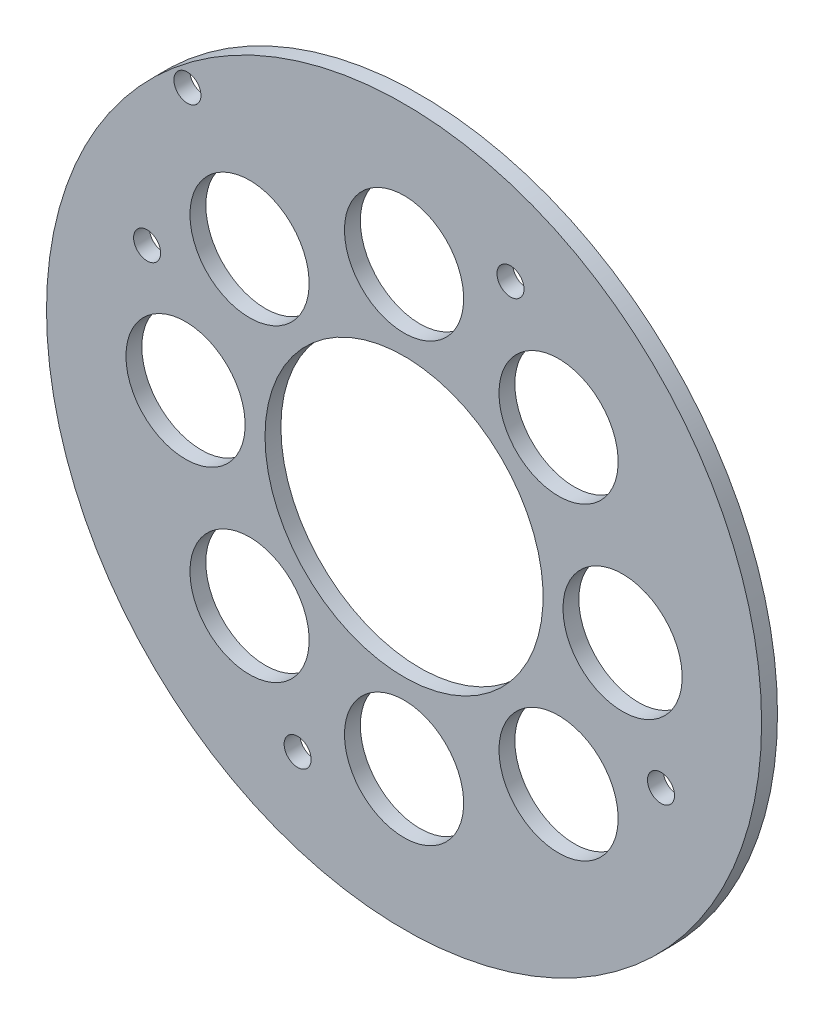
from build123d import *

# Parameters (mm, degrees)
SKETCH_1_R          = 40
EXTRUDE_1_DEPTH     = 12
SKETCH_8_R          = 45
EXTRUDE_3_DEPTH     = 2
SKETCH_2_R          = 7.5
CUT_EXTRUDE_1_DEPTH = 66.161338231
HOLE_WIZARD_M31_D   = 3.4
HOLE_WIZARD_M32_D   = 3.4
SKETCH_10_R         = 7.5
CUT_EXTRUDE_2_DEPTH = 66.161338231
HOLE_WIZARD_M33_D   = 3.4
SKETCH_17_R         = 17
CUT_EXTRUDE_3_DEPTH = 1.5
SKETCH_18_R         = 44.163841719
CUT_EXTRUDE_4_DEPTH = 12
SKETCH_19_R         = 17.5
CUT_EXTRUDE_5_DEPTH = 64.671029519


with BuildPart() as part:
    # Эскиз1 → Бобышка-Вытянуть1 (new body)
    with BuildSketch(Plane.XY):
        Circle(SKETCH_1_R)
    extrude(amount=EXTRUDE_1_DEPTH)

    # Эскиз8 → Бобышка-Вытянуть3 (add)
    with BuildSketch(Plane.XY.offset(12)):
        Circle(SKETCH_8_R)
    extrude(amount=EXTRUDE_3_DEPTH)

    # Эскиз2 → Вырез-Вытянуть1 (cut, through all)
    with BuildSketch(Plane(origin=(0, 0, 14), x_dir=(-1, 0, 0), z_dir=(0, 0, -1))):
        Circle(SKETCH_2_R)
    extrude(amount=CUT_EXTRUDE_1_DEPTH, mode=Mode.SUBTRACT)

    # Отверстие с зазором M31 (through all)
    with Locations(Plane(origin=(-6.663493146, -3.889871465, 14), x_dir=(-1, 0, 0), z_dir=(0, 0, 1))):
        with Locations((20.599623529, -37.010635762)):
            Hole(HOLE_WIZARD_M31_D / 2)

    # Отверстие с зазором M32 (through all)
    with Locations(Plane.XY.offset(14)):
        with Locations((0, 12.5), (-12.5, 0), (0, -12.5), (12.5, 0)):
            Hole(HOLE_WIZARD_M32_D / 2)

    # Эскиз10 → Вырез-Вытянуть2 (cut, through all)
    with BuildSketch(Plane(origin=(0, 0, 0), x_dir=(-1, 0, 0), z_dir=(0, 0, -1))):
        with Locations((0, 27.5)):
            Circle(SKETCH_10_R)
        with Locations((19.445436483, 19.445436483)):
            Circle(SKETCH_10_R)
        with Locations((27.5, 0)):
            Circle(SKETCH_10_R)
        with Locations((19.445436483, -19.445436483)):
            Circle(SKETCH_10_R)
        with Locations((0, -27.5)):
            Circle(SKETCH_10_R)
        with Locations((-19.445436483, -19.445436483)):
            Circle(SKETCH_10_R)
        with Locations((-27.5, 0)):
            Circle(SKETCH_10_R)
        with Locations((-19.445436483, 19.445436483)):
            Circle(SKETCH_10_R)
    extrude(amount=-CUT_EXTRUDE_2_DEPTH, mode=Mode.SUBTRACT)

    # Отверстие с зазором M33 (through all)
    with Locations(Plane(origin=(0, 0, 0), x_dir=(-1, 0, 0), z_dir=(0, 0, -1))):
        with Locations((-13.393920133, 32.335783638), (13.393920133, -32.335783638), (32.335783638, 13.393920133), (-32.335783638, -13.393920133)):
            Hole(HOLE_WIZARD_M33_D / 2)

    # Эскиз17 → Вырез-Вытянуть3 (cut)
    with BuildSketch(Plane(origin=(0, 0, 0), x_dir=(-1, 0, 0), z_dir=(0, 0, -1))):
        Circle(SKETCH_17_R)
    extrude(amount=-CUT_EXTRUDE_3_DEPTH, mode=Mode.SUBTRACT)

    # Эскиз18 → Вырез-Вытянуть4 (cut)
    with BuildSketch(Plane(origin=(0, 0, 0), x_dir=(-1, 0, 0), z_dir=(0, 0, -1))):
        Circle(SKETCH_18_R)
    extrude(amount=-CUT_EXTRUDE_4_DEPTH, mode=Mode.SUBTRACT)

    # Эскиз19 → Вырез-Вытянуть5 (cut, through all)
    with BuildSketch(Plane(origin=(0, 0, 12), x_dir=(-1, 0, 0), z_dir=(0, 0, -1))):
        Circle(SKETCH_19_R)
    extrude(amount=-CUT_EXTRUDE_5_DEPTH, mode=Mode.SUBTRACT)


solid = part.part
